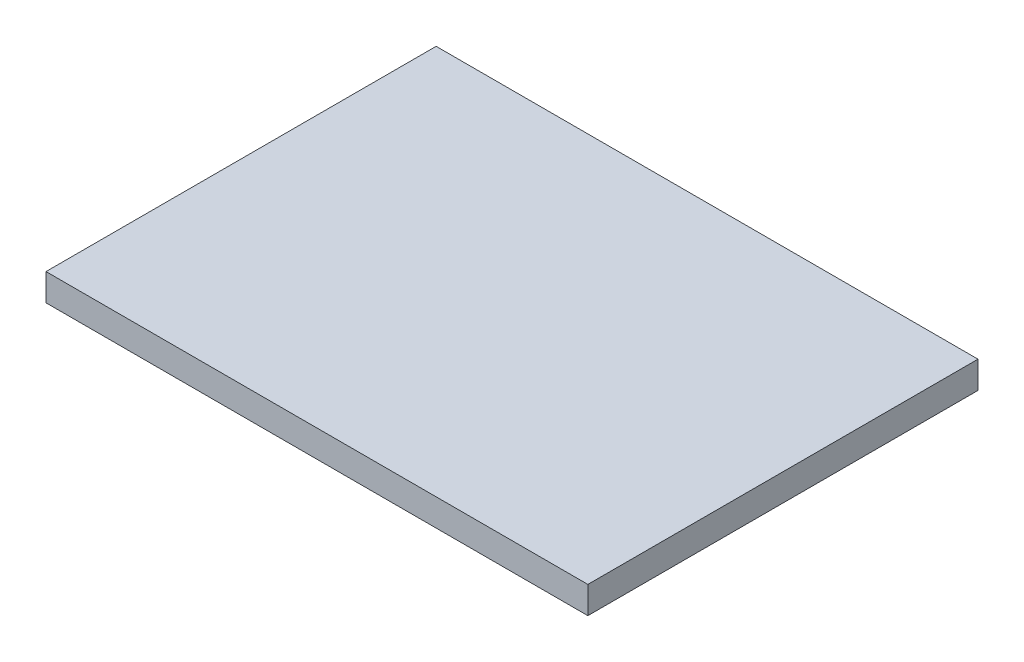
from build123d import *

# Parameters (mm, degrees)
SKETCH1_W           = 63.5
SKETCH1_H           = 45.72
BOSS_EXTRUDE1_DEPTH = 3.175


with BuildPart() as part:
    # Sketch1 → Boss-Extrude1 (new body)
    with BuildSketch(Plane(origin=(0, 0, 0), x_dir=(1, 0, 0), z_dir=(0, 1, 0))):
        with Locations((31.75, 22.86)):
            Rectangle(SKETCH1_W, SKETCH1_H)
    extrude(amount=BOSS_EXTRUDE1_DEPTH)


solid = part.part
